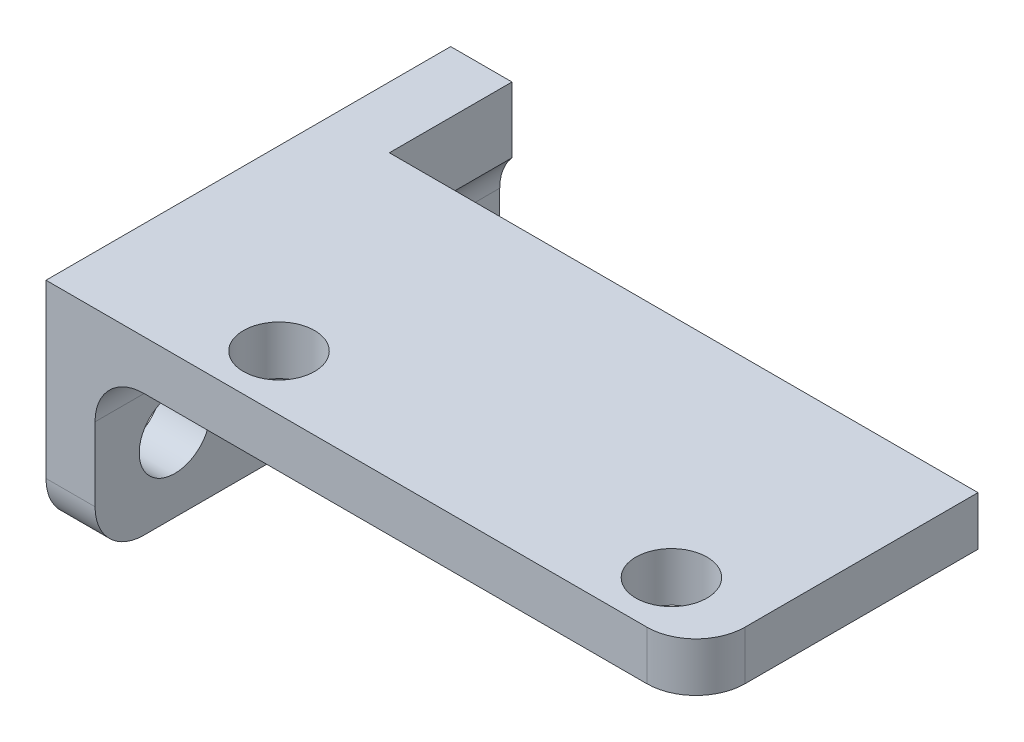
from build123d import *

# Parameters (mm, degrees)
CROQUIS2_R              = 1.45
SALIENTE_EXTRUIR1_DEPTH = 2
CROQUIS3_W              = 16.5
CROQUIS3_H              = 9
CROQUIS3_R              = 1.45
SALIENTE_EXTRUIR2_DEPTH = 2
REDONDEO1_R             = 2
REDONDEO2_R             = 2
CROQUIS4_W              = 24
CROQUIS4_H              = 5
CORTAR_EXTRUIR1_DEPTH   = 20.535224596


with BuildPart() as part:
    # Croquis2 → Saliente-Extruir1 (new body)
    with BuildSketch(Plane(origin=(0, 0, 0), x_dir=(1, 0, 0), z_dir=(0, 1, 0))):
        Polygon((-11.25, 8.25), (11.25, 8.25), (11.25, -8.25), (-11.25, -8.25), (-13.25, -8.25), (-13.25, 8.25), align=None)
        with Locations(Location((-8, -6, 0), (0, 0, 270))):
            Circle(CROQUIS2_R, mode=Mode.SUBTRACT)
        with Locations(Location((8, -6, 0), (0, 0, 90))):
            Circle(CROQUIS2_R, mode=Mode.SUBTRACT)
    extrude(amount=SALIENTE_EXTRUIR1_DEPTH)

    # Croquis3 → Saliente-Extruir2 (add)
    with BuildSketch(Plane.ZY.offset(13.25)):
        with Locations((0, -2.5)):
            Rectangle(CROQUIS3_W, CROQUIS3_H)
        with Locations((-5, -4)):
            Circle(CROQUIS3_R, mode=Mode.SUBTRACT)
        with Locations(Location((5, -4, 0), (0, 0, 180))):
            Circle(CROQUIS3_R, mode=Mode.SUBTRACT)
    extrude(amount=SALIENTE_EXTRUIR2_DEPTH)

    # Redondeo1
    redondeo1_edges = [part.edges().sort_by_distance(p)[0] for p in [
        (-13.25, 0, 0),
    ]]
    fillet(redondeo1_edges, radius=REDONDEO1_R)

    # Redondeo2
    redondeo2_edges = [part.edges().sort_by_distance(p)[0] for p in [
        (11.25, 1, 8.25),
        (11.25, 1, -8.25),
        (-14.25, -7, -8.25),
        (-14.25, -7, 8.25),
    ]]
    fillet(redondeo2_edges, radius=REDONDEO2_R)

    # Croquis4 → Cortar-Extruir1 (cut, through all)
    with BuildSketch(Plane(origin=(0, 2, 0), x_dir=(1, 0, 0), z_dir=(0, 1, 0))):
        with Locations((-0.75, 5.75)):
            Rectangle(CROQUIS4_W, CROQUIS4_H)
    extrude(amount=-CORTAR_EXTRUIR1_DEPTH, mode=Mode.SUBTRACT)


solid = part.part
